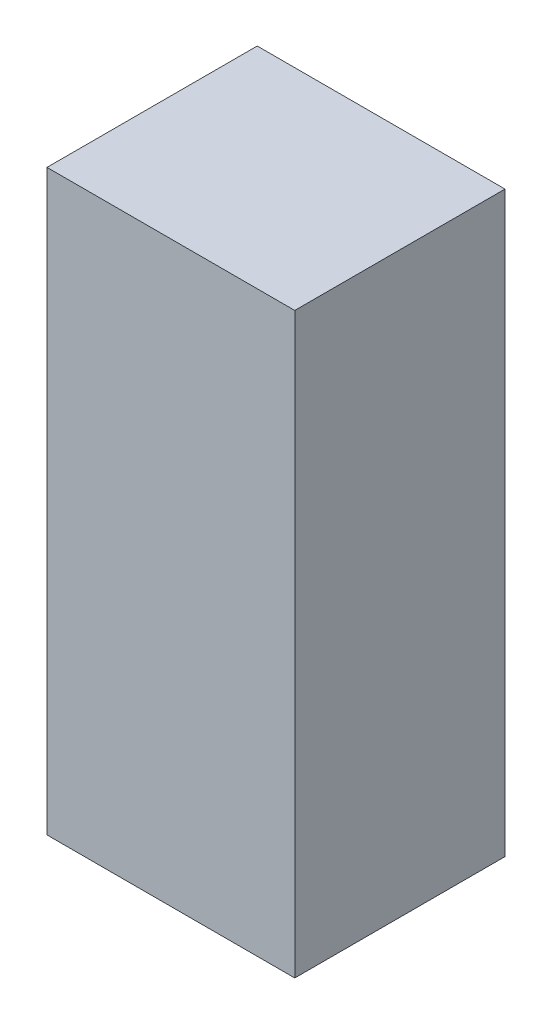
from build123d import *

# Parameters (mm, degrees)
SKETCH1_W           = 77
SKETCH1_H           = 33
BOSS_EXTRUDE1_DEPTH = 28


with BuildPart() as part:
    # Sketch1 → Boss-Extrude1 (new body)
    with BuildSketch(Plane(origin=(0, 0, 0), x_dir=(0, 1, 0), z_dir=(0, 0, 1))):
        with Locations((38.5, 16.5)):
            Rectangle(SKETCH1_W, SKETCH1_H)
    extrude(amount=BOSS_EXTRUDE1_DEPTH)


solid = part.part
